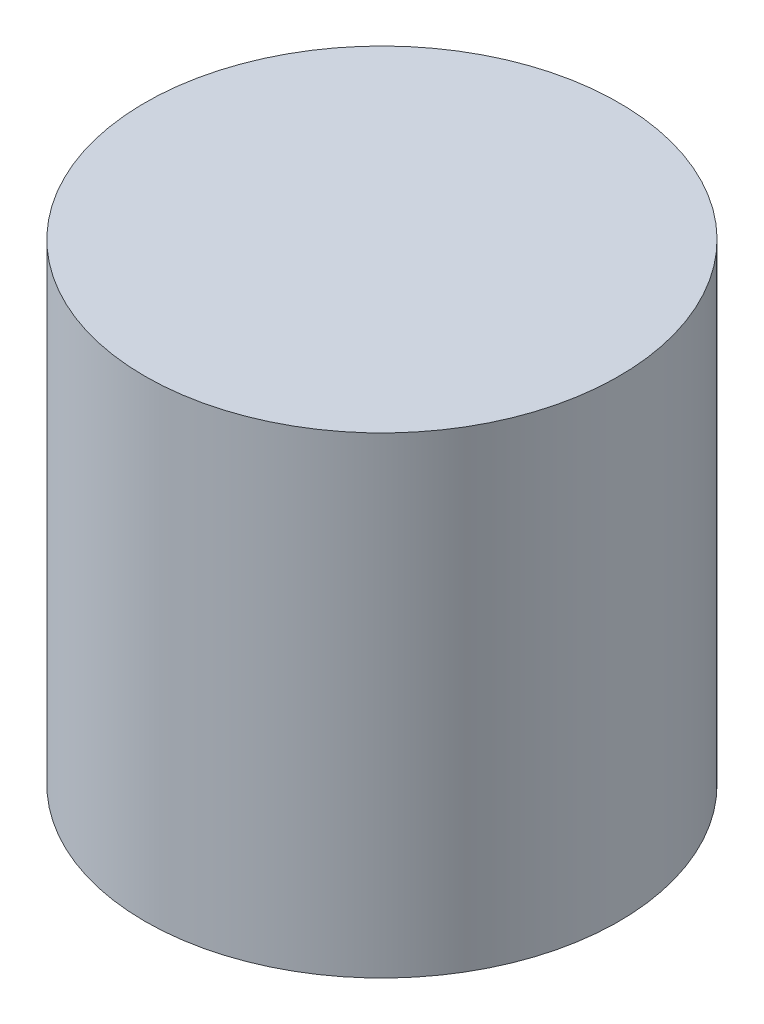
from build123d import *

# Parameters (mm, degrees)
SKETCH1_R           = 5
BOSS_EXTRUDE1_DEPTH = 9.961


with BuildPart() as part:
    # Sketch1 → Boss-Extrude1 (new body)
    with BuildSketch(Plane(origin=(0, 0, 0), x_dir=(1, 0, 0), z_dir=(0, 1, 0))):
        with Locations(Location((0, 0, 0), (0, 0, 270))):
            Circle(SKETCH1_R)
    extrude(amount=BOSS_EXTRUDE1_DEPTH)


solid = part.part
